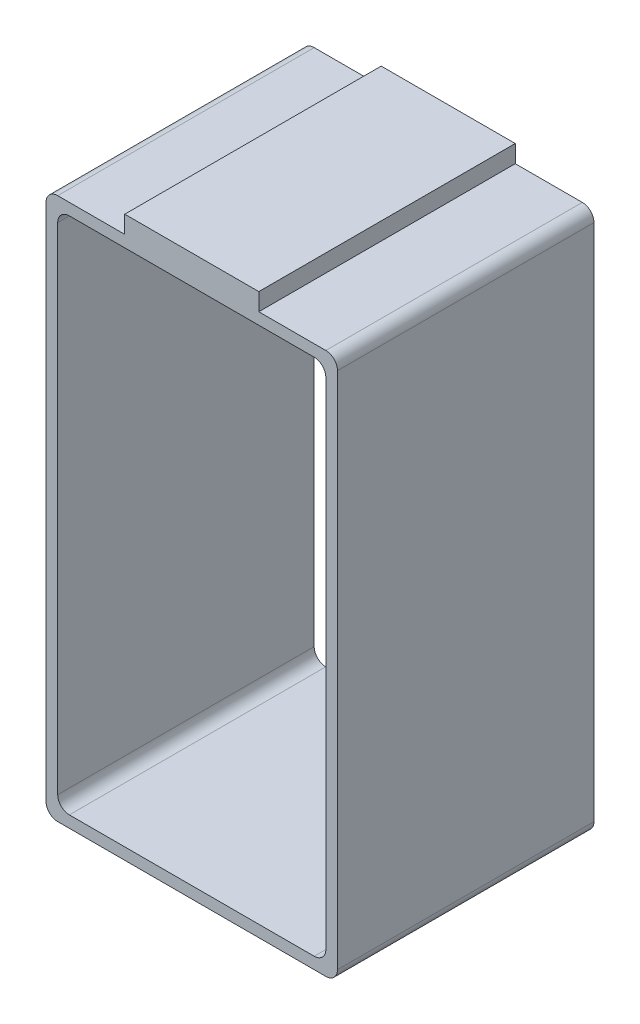
from build123d import *

# Parameters (mm, degrees)
BOSS_EXTRUDE1_DEPTH = 22
CUT_EXTRUDE1_DEPTH  = 22


with BuildPart() as part:
    # Sketch1 → Boss-Extrude1 (new body)
    with BuildSketch(Plane.XY):
        with BuildLine():
            Line((6.75, 1.5), (6.75, 0))
            Line((6.75, 0), (1, 0))
            ThreePointArc((1, 0), (0.292893219, -0.292893219), (0, -1))
            Line((0, -1), (0, -45.5))
            ThreePointArc((0, -45.5), (0.292893219, -46.207106781), (1, -46.5))
            Line((1, -46.5), (24, -46.5))
            ThreePointArc((24, -46.5), (24.707106781, -46.207106781), (25, -45.5))
            Line((25, -45.5), (25, -1))
            ThreePointArc((25, -1), (24.707106781, -0.292893219), (24, 0))
            Line((24, 0), (18.25, 0))
            Line((18.25, 0), (18.25, 1.5))
            Line((18.25, 1.5), (6.75, 1.5))
        make_face()
    extrude(amount=BOSS_EXTRUDE1_DEPTH)

    # Sketch2 → Cut-Extrude1 (cut)
    with BuildSketch(Plane.XY.offset(22)):
        with BuildLine():
            Line((2, -1), (23, -1))
            ThreePointArc((23, -1), (23.707106781, -1.292893219), (24, -2))
            Line((24, -2), (24, -44.5))
            ThreePointArc((24, -44.5), (23.707106781, -45.207106781), (23, -45.5))
            Line((23, -45.5), (2, -45.5))
            ThreePointArc((2, -45.5), (1.292893219, -45.207106781), (1, -44.5))
            Line((1, -44.5), (1, -2))
            ThreePointArc((1, -2), (1.292893219, -1.292893219), (2, -1))
        make_face()
    extrude(amount=-CUT_EXTRUDE1_DEPTH, mode=Mode.SUBTRACT)


solid = part.part
